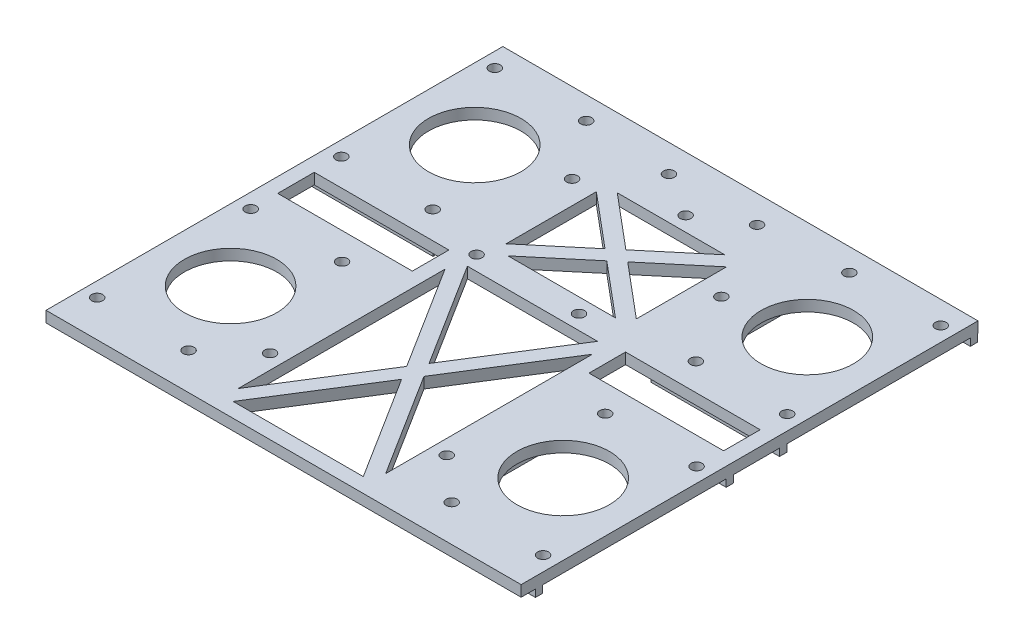
from build123d import *

# Parameters (mm, degrees)
SKETCH1_W                 = 130
SKETCH1_H                 = 125
BOSS_EXTRUDE1_DEPTH       = 5
SKETCH2_R                 = 1.5
SKETCH2_R_2               = 12.65
CUT_EXTRUDE1_DEPTH        = 10
SKETCH4_R                 = 1.5
CUT_EXTRUDE3_DEPTH        = 10
BOSS_EXTRUDE2_DEPTH       = 2
MIRROR7_COPY_1_SKETCH_R   = 1.5
MIRROR7_COPY_1_SKETCH_R_2 = 12.65
MIRROR7_COPY_1_DEPTH      = 10
MIRROR7_COPY_2_DEPTH      = 2
SKETCH10_R                = 1.5
CUT_EXTRUDE8_DEPTH        = 91.311959341
SKETCH11_R                = 2.65
CUT_EXTRUDE9_DEPTH        = 0.5
CUT_EXTRUDE10_DEPTH       = 91.444734507
CUT_EXTRUDE11_DEPTH       = 91.444734507
CUT_EXTRUDE12_DEPTH       = 91.444734507
SKETCH15_W                = 130
SKETCH15_H                = 125
SKETCH15_W_2              = 5
SKETCH15_H_2              = 5
CUT_EXTRUDE14_DEPTH       = 2
CUT_EXTRUDE15_START       = -8
SKETCH17_W                = 137.629855092
SKETCH17_H                = 131.076052468
CUT_EXTRUDE15_DEPTH       = 2


with BuildPart() as part:
    # Sketch1 → Boss-Extrude1 (new body)
    with BuildSketch(Plane(origin=(0, 0, 0), x_dir=(1, 0, 0), z_dir=(0, 1, 0))):
        Rectangle(SKETCH1_W, SKETCH1_H)
    extrude(amount=BOSS_EXTRUDE1_DEPTH)

    # Sketch2 → Cut-Extrude1 (cut)
    with BuildSketch(Plane(origin=(0, 5, 0), x_dir=(1, 0, 0), z_dir=(0, 1, 0))):
        with Locations(Location((-61, -52.5, 0), (0, 0, 270))):
            Circle(SKETCH2_R)
        with Locations(Location((-36, -52.5, 0), (0, 0, 270))):
            Circle(SKETCH2_R)
        with Locations(Location((-36, -10.5, 0), (0, 0, 270))):
            Circle(SKETCH2_R)
        with Locations(Location((-61, -10.5, 0), (0, 0, 270))):
            Circle(SKETCH2_R)
        with Locations(Location((-45.5, -31.5, 0), (0, 0, 270))):
            Circle(SKETCH2_R_2)
    cut_extrude1 = extrude(amount=-CUT_EXTRUDE1_DEPTH, mode=Mode.SUBTRACT)

    # Mirror3: Cut-Extrude1 across plane
    add(cut_extrude1.mirror(Plane.ZY), mode=Mode.SUBTRACT)

    # Sketch4 → Cut-Extrude3 (cut)
    with BuildSketch(Plane(origin=(0, 5, 0), x_dir=(1, 0, 0), z_dir=(0, 1, 0))):
        with Locations(Location((0, 47.5, 0), (0, 0, 270))):
            Circle(SKETCH4_R)
        with Locations(Location((12.049810205, 55, 0), (0, 0, 270))):
            Circle(SKETCH4_R)
        with Locations(Location((-12.049810205, 55, 0), (0, 0, 270))):
            Circle(SKETCH4_R)
    extrude(amount=-CUT_EXTRUDE3_DEPTH, mode=Mode.SUBTRACT)

    # Sketch5 → Boss-Extrude2 (add)
    with BuildSketch(Plane.XZ):
        Polygon((-65, 58.6), (-65, 56.6), (-31.8, 56.6), (-31.8, 6.4), (-65, 6.4), (-65, 4.4), (-29.8, 4.4), (-29.8, 58.6), align=None)
    boss_extrude2 = extrude(amount=BOSS_EXTRUDE2_DEPTH)

    # Mirror5: Boss-Extrude2 across plane
    add(boss_extrude2.mirror(Plane.ZY))

    # Mirror7: Cut-Extrude1, Boss-Extrude2 across plane
    add(cut_extrude1.mirror(Plane.XY.offset(-1.9)), mode=Mode.SUBTRACT)
    add(boss_extrude2.mirror(Plane.XY.offset(-1.9)))

    # Mirror7 copy 1 sketch → Mirror7 copy 1 (cut)
    with BuildSketch(Plane(origin=(0, 5, -3.8), x_dir=(-1, 0, 0), z_dir=(0, 1, 0))):
        with Locations(Location((-61, -52.5, 0), (0, 0, 270))):
            Circle(MIRROR7_COPY_1_SKETCH_R)
        with Locations(Location((-36, -52.5, 0), (0, 0, 270))):
            Circle(MIRROR7_COPY_1_SKETCH_R)
        with Locations(Location((-36, -10.5, 0), (0, 0, 270))):
            Circle(MIRROR7_COPY_1_SKETCH_R)
        with Locations(Location((-61, -10.5, 0), (0, 0, 270))):
            Circle(MIRROR7_COPY_1_SKETCH_R)
        with Locations(Location((-45.5, -31.5, 0), (0, 0, 270))):
            Circle(MIRROR7_COPY_1_SKETCH_R_2)
    extrude(amount=-MIRROR7_COPY_1_DEPTH, mode=Mode.SUBTRACT)

    # Mirror7 copy 2 sketch → Mirror7 copy 2 (add)
    with BuildSketch(Plane(origin=(0, 0, -3.8), x_dir=(-1, 0, 0), z_dir=(0, -1, 0))):
        Polygon((-65, 58.6), (-65, 56.6), (-31.8, 56.6), (-31.8, 6.4), (-65, 6.4), (-65, 4.4), (-29.8, 4.4), (-29.8, 58.6), align=None)
    extrude(amount=MIRROR7_COPY_2_DEPTH)

    # Sketch10 → Cut-Extrude8 (cut, through all)
    with BuildSketch(Plane(origin=(0, 0, 0), x_dir=(-1, 0, 0), z_dir=(0, -1, 0))):
        with Locations(Location((-24.17, -42.03, 0), (0, 0, 90))):
            Circle(SKETCH10_R)
        with Locations(Location((24.17, -42.03, 0), (0, 0, 90))):
            Circle(SKETCH10_R)
        with Locations(Location((-8.73, 9.6, 0), (0, 0, 90))):
            Circle(SKETCH10_R)
        with Locations(Location((19.29, 9.6, 0), (0, 0, 90))):
            Circle(SKETCH10_R)
        with Locations(Location((-24.17, 33.11, 0), (0, 0, 90))):
            Circle(SKETCH10_R)
        with Locations(Location((24.17, 40.6, 0), (0, 0, 90))):
            Circle(SKETCH10_R)
    extrude(amount=-CUT_EXTRUDE8_DEPTH, mode=Mode.SUBTRACT)

    # Sketch11 → Cut-Extrude9 (cut)
    with BuildSketch(Plane.XZ):
        with Locations(Location((-12.049810205, -55, 0), (0, 0, 270))):
            Circle(SKETCH11_R)
        with Locations(Location((0, -47.5, 0), (0, 0, 270))):
            Circle(SKETCH11_R)
        with Locations(Location((12.049810205, -55, 0), (0, 0, 270))):
            Circle(SKETCH11_R)
        with Locations(Location((-24.17, -40.6, 0), (0, 0, 270))):
            Circle(SKETCH11_R)
        with Locations(Location((24.17, -33.11, 0), (0, 0, 270))):
            Circle(SKETCH11_R)
        with Locations(Location((8.73, -9.6, 0), (0, 0, 270))):
            Circle(SKETCH11_R)
        with Locations(Location((-19.29, -9.6, 0), (0, 0, 270))):
            Circle(SKETCH11_R)
        with Locations(Location((-24.17, 42.03, 0), (0, 0, 270))):
            Circle(SKETCH11_R)
        with Locations(Location((24.17, 42.03, 0), (0, 0, 270))):
            Circle(SKETCH11_R)
        with Locations(Location((-61, -14.3, 0), (0, 0, 270))):
            Circle(SKETCH11_R)
        with Locations(Location((-36, -14.3, 0), (0, 0, 270))):
            Circle(SKETCH11_R)
        with Locations(Location((-61, -56.3, 0), (0, 0, 270))):
            Circle(SKETCH11_R)
        with Locations(Location((-36, -56.3, 0), (0, 0, 270))):
            Circle(SKETCH11_R)
        with Locations(Location((36, -56.3, 0), (0, 0, 270))):
            Circle(SKETCH11_R)
        with Locations(Location((61, -56.3, 0), (0, 0, 270))):
            Circle(SKETCH11_R)
        with Locations(Location((36, -14.3, 0), (0, 0, 270))):
            Circle(SKETCH11_R)
        with Locations(Location((61, -14.3, 0), (0, 0, 270))):
            Circle(SKETCH11_R)
        with Locations(Location((36, 10.5, 0), (0, 0, 270))):
            Circle(SKETCH11_R)
        with Locations(Location((61, 10.5, 0), (0, 0, 270))):
            Circle(SKETCH11_R)
        with Locations(Location((61, 52.5, 0), (0, 0, 270))):
            Circle(SKETCH11_R)
        with Locations(Location((36, 52.5, 0), (0, 0, 270))):
            Circle(SKETCH11_R)
        with Locations(Location((-36, 52.5, 0), (0, 0, 270))):
            Circle(SKETCH11_R)
        with Locations(Location((-36, 10.5, 0), (0, 0, 270))):
            Circle(SKETCH11_R)
        with Locations(Location((-61, 10.5, 0), (0, 0, 270))):
            Circle(SKETCH11_R)
        with Locations(Location((-61, 52.5, 0), (0, 0, 270))):
            Circle(SKETCH11_R)
    extrude(amount=-CUT_EXTRUDE9_DEPTH, mode=Mode.SUBTRACT)

    # Sketch12 → Cut-Extrude10 (cut, through all)
    with BuildSketch(Plane(origin=(0, 5, 0), x_dir=(1, 0, 0), z_dir=(0, 1, 0))):
        Polygon((-2.363095604, -26.45), (-20.17, 1.845056316), (-20.17, -54.745056316), align=None)
        Polygon((17.806904396, 5.6), (-17.806904396, 5.6), (0, -22.695056316), align=None)
        Polygon((20.17, -54.745056316), (20.17, 1.845056316), (2.363095604, -26.45), align=None)
        Polygon((0, -30.204943684), (-17.806904396, -58.5), (17.806904396, -58.5), align=None)
    extrude(amount=-CUT_EXTRUDE10_DEPTH, mode=Mode.SUBTRACT)

    # Sketch13 → Cut-Extrude11 (cut, through all)
    with BuildSketch(Plane(origin=(0, 5, 0), x_dir=(1, 0, 0), z_dir=(0, 1, 0))):
        Polygon((-61, 1.9), (-61, -3.1), (-24.17, -3.1), (-24.17, 6.9), (-61, 6.9), align=None)
    cut_extrude11 = extrude(amount=-CUT_EXTRUDE11_DEPTH, mode=Mode.SUBTRACT)

    # Mirror9: Cut-Extrude11 across plane
    add(cut_extrude11.mirror(Plane.ZY), mode=Mode.SUBTRACT)

    # Sketch14 → Cut-Extrude12 (cut, through all)
    with BuildSketch(Plane(origin=(0, 5, 0), x_dir=(1, 0, 0), z_dir=(0, 1, 0))):
        Polygon((-3.110442245, 28.55), (-17.806904396, 40.888590935), (-17.806904396, 16.211409065), align=None)
        Polygon((14.696462151, 43.5), (-14.696462151, 43.5), (0, 31.161409065), align=None)
        Polygon((17.806904396, 16.211409065), (17.806904396, 40.888590935), (3.110442245, 28.55), align=None)
        Polygon((0, 25.938590935), (-14.696462151, 13.6), (14.696462151, 13.6), align=None)
    extrude(amount=-CUT_EXTRUDE12_DEPTH, mode=Mode.SUBTRACT)

    # Sketch15 → Cut-Extrude14 (cut)
    with BuildSketch(Plane(origin=(0, 5, 0), x_dir=(1, 0, 0), z_dir=(0, 1, 0))):
        Rectangle(SKETCH15_W, SKETCH15_H)
        with Locations((-61, 56.3)):
            Rectangle(SKETCH15_W_2, SKETCH15_H_2, mode=Mode.SUBTRACT)
        with Locations((-36, 56.3)):
            Rectangle(SKETCH15_W_2, SKETCH15_H_2, mode=Mode.SUBTRACT)
        with Locations((-12.049810205, 55)):
            Rectangle(SKETCH15_W_2, SKETCH15_H_2, mode=Mode.SUBTRACT)
        with Locations((0, 47.5)):
            Rectangle(SKETCH15_W_2, SKETCH15_H_2, mode=Mode.SUBTRACT)
        with Locations((12.049810205, 55)):
            Rectangle(SKETCH15_W_2, SKETCH15_H_2, mode=Mode.SUBTRACT)
        with Locations((36, 56.3)):
            Rectangle(SKETCH15_W_2, SKETCH15_H_2, mode=Mode.SUBTRACT)
        with Locations((61, 56.3)):
            Rectangle(SKETCH15_W_2, SKETCH15_H_2, mode=Mode.SUBTRACT)
        with Locations((36, 14.3)):
            Rectangle(SKETCH15_W_2, SKETCH15_H_2, mode=Mode.SUBTRACT)
        with Locations((61, 14.3)):
            Rectangle(SKETCH15_W_2, SKETCH15_H_2, mode=Mode.SUBTRACT)
        with Locations((24.17, 33.11)):
            Rectangle(SKETCH15_W_2, SKETCH15_H_2, mode=Mode.SUBTRACT)
        with Locations((36, -10.5)):
            Rectangle(SKETCH15_W_2, SKETCH15_H_2, mode=Mode.SUBTRACT)
        with Locations((61, -10.5)):
            Rectangle(SKETCH15_W_2, SKETCH15_H_2, mode=Mode.SUBTRACT)
        with Locations((24.17, -42.03)):
            Rectangle(SKETCH15_W_2, SKETCH15_H_2, mode=Mode.SUBTRACT)
        with Locations((36, -52.5)):
            Rectangle(SKETCH15_W_2, SKETCH15_H_2, mode=Mode.SUBTRACT)
        with Locations((61, -52.5)):
            Rectangle(SKETCH15_W_2, SKETCH15_H_2, mode=Mode.SUBTRACT)
        with Locations((-24.17, -42.03)):
            Rectangle(SKETCH15_W_2, SKETCH15_H_2, mode=Mode.SUBTRACT)
        with Locations((-36, -52.5)):
            Rectangle(SKETCH15_W_2, SKETCH15_H_2, mode=Mode.SUBTRACT)
        with Locations((-36, -10.5)):
            Rectangle(SKETCH15_W_2, SKETCH15_H_2, mode=Mode.SUBTRACT)
        with Locations((8.73, 9.6)):
            Rectangle(SKETCH15_W_2, SKETCH15_H_2, mode=Mode.SUBTRACT)
        with Locations((-19.29, 9.6)):
            Rectangle(SKETCH15_W_2, SKETCH15_H_2, mode=Mode.SUBTRACT)
        with Locations((-24.17, 40.6)):
            Rectangle(SKETCH15_W_2, SKETCH15_H_2, mode=Mode.SUBTRACT)
        with Locations((-61, 14.3)):
            Rectangle(SKETCH15_W_2, SKETCH15_H_2, mode=Mode.SUBTRACT)
        with Locations((-36, 14.3)):
            Rectangle(SKETCH15_W_2, SKETCH15_H_2, mode=Mode.SUBTRACT)
        with Locations((-61, -10.5)):
            Rectangle(SKETCH15_W_2, SKETCH15_H_2, mode=Mode.SUBTRACT)
        with Locations((-61, -52.5)):
            Rectangle(SKETCH15_W_2, SKETCH15_H_2, mode=Mode.SUBTRACT)
    extrude(amount=-CUT_EXTRUDE14_DEPTH, mode=Mode.SUBTRACT)

    # Sketch17 → Cut-Extrude15 (cut)
    with BuildSketch(Plane(origin=(0, 13, 0), x_dir=(1, 0, 0), z_dir=(0, 1, 0)).offset(CUT_EXTRUDE15_START)):
        with Locations((0.756207995, -1.260346658)):
            Rectangle(SKETCH17_W, SKETCH17_H)
    extrude(amount=-CUT_EXTRUDE15_DEPTH, mode=Mode.SUBTRACT)


solid = part.part
